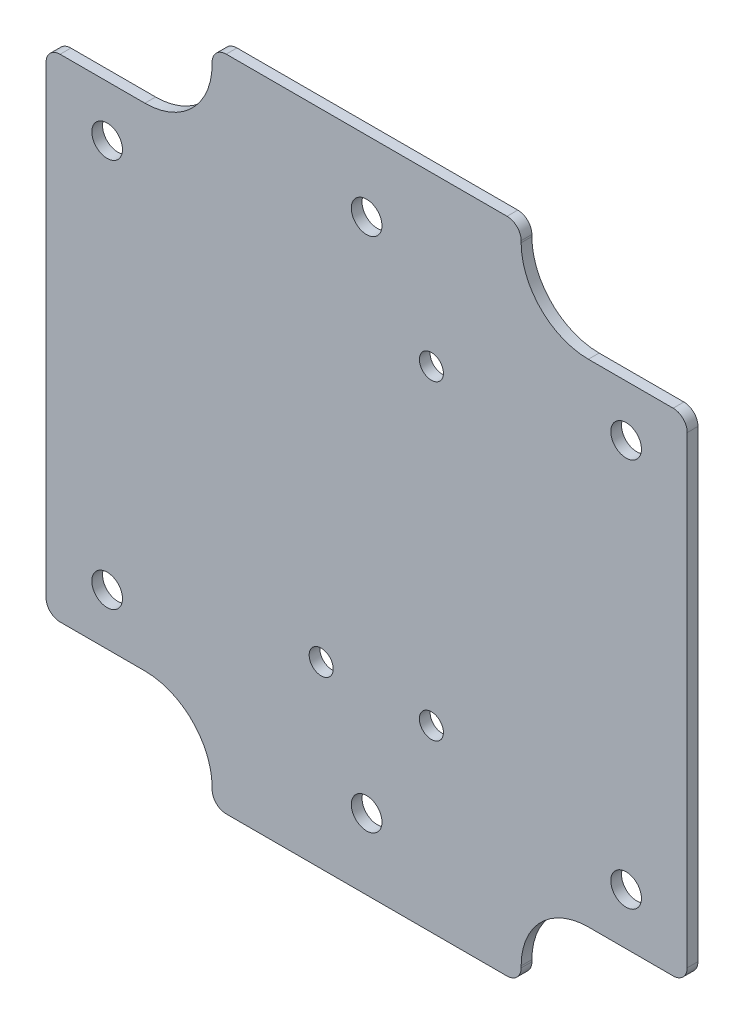
from build123d import *

# Parameters (mm, degrees)
SKETCH1_R           = 1.7145
MAINBODY_DEPTH      = 1.2
LARGEROUNDS_R       = 7.5184
SMALLROUNDS_R       = 1.5748
PCBMOUNTHOLES_REACH = 82.573
SKETCH2_R           = 1.345


with BuildPart() as part:
    # Sketch1 → MainBody (new body)
    with BuildSketch(Plane.XY):
        Polygon((71.6788, -27.4828), (71.6788, 27.4828), (53.1114, 27.4828), (53.1114, 36.7792), (18.5674, 36.7792), (18.5674, 27.4828), (0, 27.4828), (0, -27.4828), (18.5674, -27.4828), (18.5674, -36.7792), (53.1114, -36.7792), (53.1114, -27.4828), align=None)
        with Locations((64.8462, -21.7424)):
            Circle(SKETCH1_R, mode=Mode.SUBTRACT)
        with Locations(Location((6.8326, -21.7424, 0), (0, 0, 180))):
            Circle(SKETCH1_R, mode=Mode.SUBTRACT)
        with Locations((6.8326, 21.7424)):
            Circle(SKETCH1_R, mode=Mode.SUBTRACT)
        with Locations(Location((64.8462, 21.7424, 0), (0, 0, 180))):
            Circle(SKETCH1_R, mode=Mode.SUBTRACT)
        with Locations((35.8394, -28.8671)):
            Circle(SKETCH1_R, mode=Mode.SUBTRACT)
        with Locations(Location((35.8394, 28.8671, 0), (0, 0, 180))):
            Circle(SKETCH1_R, mode=Mode.SUBTRACT)
    extrude(amount=MAINBODY_DEPTH)

    # LargeRounds
    largerounds_edges = [part.edges().sort_by_distance(p)[0] for p in [
        (53.1114, -27.4828, 0.6),
        (18.5674, -27.4828, 0.6),
        (18.5674, 27.4828, 0.6),
        (53.1114, 27.4828, 0.6),
    ]]
    fillet(largerounds_edges, radius=LARGEROUNDS_R)

    # SmallRounds
    smallrounds_edges = [part.edges().sort_by_distance(p)[0] for p in [
        (53.1114, -36.7792, 0.6),
        (18.5674, -36.7792, 0.6),
        (0, -27.4828, 0.6),
        (0, 27.4828, 0.6),
        (18.5674, 36.7792, 0.6),
        (53.1114, 36.7792, 0.6),
        (71.6788, 27.4828, 0.6),
        (71.6788, -27.4828, 0.6),
    ]]
    fillet(smallrounds_edges, radius=SMALLROUNDS_R)

    # Sketch2 → PCBMountHoles (cut, up to next)
    with BuildSketch(Plane.XY.offset(1.2), mode=Mode.PRIVATE) as pcbmountholes_sk1:
        with Locations((30.7594, -16.76)):
            Circle(SKETCH2_R)
    pcbmountholes_tool1 = extrude(pcbmountholes_sk1.sketch, amount=-PCBMOUNTHOLES_REACH, mode=Mode.PRIVATE) & part.part
    # Sketch2 → PCBMountHoles (cut, up to next)
    with BuildSketch(Plane.XY.offset(1.2), mode=Mode.PRIVATE) as pcbmountholes_sk2:
        with Locations((43.0794, -16.76)):
            Circle(SKETCH2_R)
    pcbmountholes_tool2 = extrude(pcbmountholes_sk2.sketch, amount=-PCBMOUNTHOLES_REACH, mode=Mode.PRIVATE) & part.part
    # Sketch2 → PCBMountHoles (cut, up to next)
    with BuildSketch(Plane.XY.offset(1.2), mode=Mode.PRIVATE) as pcbmountholes_sk3:
        with Locations((43.0794, 18.02)):
            Circle(SKETCH2_R)
    pcbmountholes_tool3 = extrude(pcbmountholes_sk3.sketch, amount=-PCBMOUNTHOLES_REACH, mode=Mode.PRIVATE) & part.part
    add(pcbmountholes_tool1.solids().sort_by_distance((30.7594, -16.76, 1.2))[0], mode=Mode.SUBTRACT)
    add(pcbmountholes_tool2.solids().sort_by_distance((43.0794, -16.76, 1.2))[0], mode=Mode.SUBTRACT)
    add(pcbmountholes_tool3.solids().sort_by_distance((43.0794, 18.02, 1.2))[0], mode=Mode.SUBTRACT)


solid = part.part
